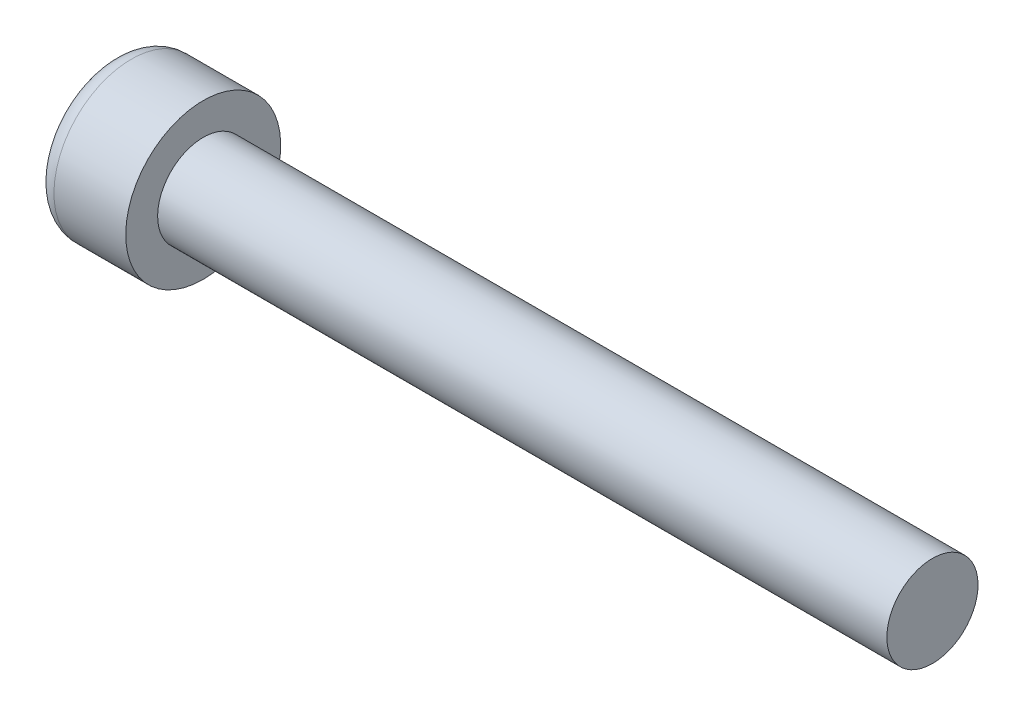
from build123d import *

# Parameters (mm, degrees)
CUT_EXTRUDE1_DEPTH = 2.5


with BuildPart() as part:
    # Sketch1 → Revolve1 (revolve)
    with BuildSketch(Plane.XY, mode=Mode.PRIVATE) as revolve1_sk:
        with BuildLine():
            Line((0, 0), (0, 3.1875))
            ThreePointArc((0, 3.1875), (0.311199045, 3.938800955), (1.0625, 4.25))
            Line((1.0625, 4.25), (5, 4.25))
            Line((5, 4.25), (5, 2.5))
            Line((5, 2.5), (45, 2.5))
            Line((45, 2.5), (45, 0))
            Line((45, 0), (0, 0))
        make_face()
    revolve(revolve1_sk.sketch.rotate(Axis((0, 0, 0), (1, 0, 0)), 180), axis=Axis((0, 0, 0), (1, 0, 0)))

    # Sketch2 → Cut-Extrude1 (cut)
    with BuildSketch(Plane.ZY):
        Polygon((0, 2.309401077), (-2, 1.154700538), (-2, -1.154700538), (0, -2.309401077), (2, -1.154700538), (2, 1.154700538), align=None)
    extrude(amount=-CUT_EXTRUDE1_DEPTH, mode=Mode.SUBTRACT)


solid = part.part
